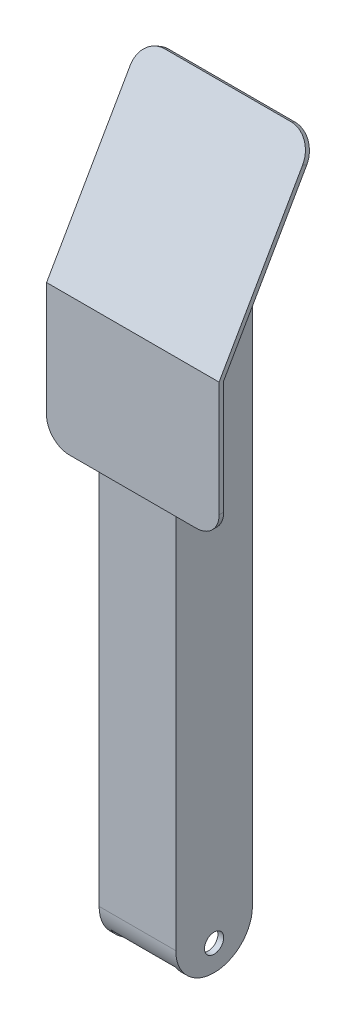
from build123d import *

# Parameters (mm, degrees)
SKETCH1_W               = 25.4
SKETCH1_H               = 25.4
SKETCH1_W_2             = 21.59
SKETCH1_H_2             = 21.59
BOSS_EXTRUDE1_DEPTH     = 228.6
CUT_EXTRUDE1_DEPTH      = 230.304470083
CUT_EXTRUDE1_DEPTH_BACK = 230.304470083
SKETCH2_R               = 3.175
BOSS_EXTRUDE2_DEPTH     = 28.575
FILLET1_R               = 7.62


with BuildPart() as part:
    # Sketch1 → Boss-Extrude1 (new body)
    with BuildSketch(Plane(origin=(0, 0, 0), x_dir=(1, 0, 0), z_dir=(0, 1, 0))):
        Rectangle(SKETCH1_W, SKETCH1_H)
        Rectangle(SKETCH1_W_2, SKETCH1_H_2, mode=Mode.SUBTRACT)
    extrude(amount=BOSS_EXTRUDE1_DEPTH)

    # Sketch2 → Cut-Extrude1 (cut, two sides: drawn at the far end of the back side and taken through both)
    with BuildSketch(Plane(origin=(0, 0, 0), x_dir=(0, 0, -1), z_dir=(1, 0, 0)).offset(-CUT_EXTRUDE1_DEPTH_BACK)):
        Polygon((-12.7, 228.6), (-12.7, 184.15), (12.7, 228.6), align=None)
        with BuildLine():
            Line((-12.7, 0), (0, 0))
            ThreePointArc((0, 0), (-8.980256121, 3.719743879), (-12.7, 12.7))
            Line((-12.7, 12.7), (-12.7, 0))
        make_face()
        with BuildLine():
            ThreePointArc((12.7, 12.7), (8.980256121, 3.719743879), (0, 0))
            Line((0, 0), (12.7, 0))
            Line((12.7, 0), (12.7, 12.7))
        make_face()
        with Locations((0, 8.509)):
            Circle(SKETCH2_R)
    extrude(amount=CUT_EXTRUDE1_DEPTH + CUT_EXTRUDE1_DEPTH_BACK, mode=Mode.SUBTRACT)

    # Sketch3 → Boss-Extrude2 (add, symmetric)
    with BuildSketch(Plane(origin=(0, 0, 0), x_dir=(0, 0, -1), z_dir=(1, 0, 0))):
        Polygon((-12.7, 184.15), (18.604025134, 238.932043985), (17.280822586, 239.688159727), (-14.224, 184.554720202), (-14.224, 138.834720202), (-12.7, 138.834720202), align=None)
    extrude(amount=BOSS_EXTRUDE2_DEPTH, both=True)

    # Fillet1
    fillet1_edges = [part.edges().sort_by_distance(p)[0] for p in [
        (-28.575, 239.310101856, -17.94242386),
        (-28.575, 138.834720202, 13.462),
        (28.575, 239.310101856, -17.94242386),
        (28.575, 138.834720202, 13.462),
    ]]
    fillet(fillet1_edges, radius=FILLET1_R)


solid = part.part
